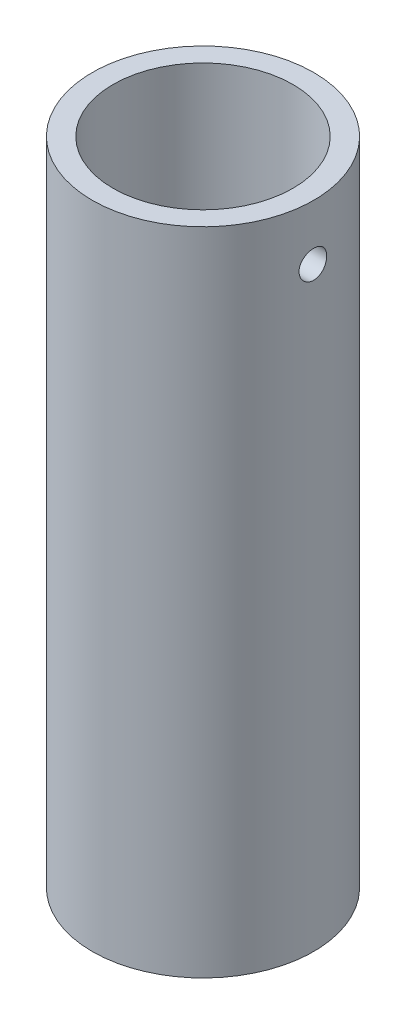
from build123d import *

# Parameters (mm, degrees)
SKETCH3_R                  = 8
SKETCH3_R_2                = 6.5
EXTRUDE_THIN1_DEPTH        = 23.5
F_2_0MM_DOWEL_HOLE1_REACH  = 48.573
F_2_0MM_DOWEL_HOLE1_BORE_R = 1


with BuildPart() as part:
    # Sketch3 → Extrude-Thin1 (new, symmetric)
    with BuildSketch(Plane(origin=(0, 0, 0), x_dir=(1, 0, 0), z_dir=(0, 1, 0))):
        Circle(SKETCH3_R)
        Circle(SKETCH3_R_2, mode=Mode.SUBTRACT)
    extrude(amount=EXTRUDE_THIN1_DEPTH, both=True)

    # Ø2.0mm Dowel Hole1 bore (on position points) → Ø2.0mm Dowel Hole1 (cut, up to next)
    with BuildSketch(Plane(origin=(8, 19.5, 0), x_dir=(0, 0, 1), z_dir=(1, 0, 0)), mode=Mode.PRIVATE) as f_2_0mm_dowel_hole1_sk1:
        Circle(F_2_0MM_DOWEL_HOLE1_BORE_R)
    f_2_0mm_dowel_hole1_tool1 = extrude(f_2_0mm_dowel_hole1_sk1.sketch, amount=-F_2_0MM_DOWEL_HOLE1_REACH, mode=Mode.PRIVATE) & part.part
    add(f_2_0mm_dowel_hole1_tool1.solids().sort_by_distance((8, 19.5, 0))[0], mode=Mode.SUBTRACT)


solid = part.part
